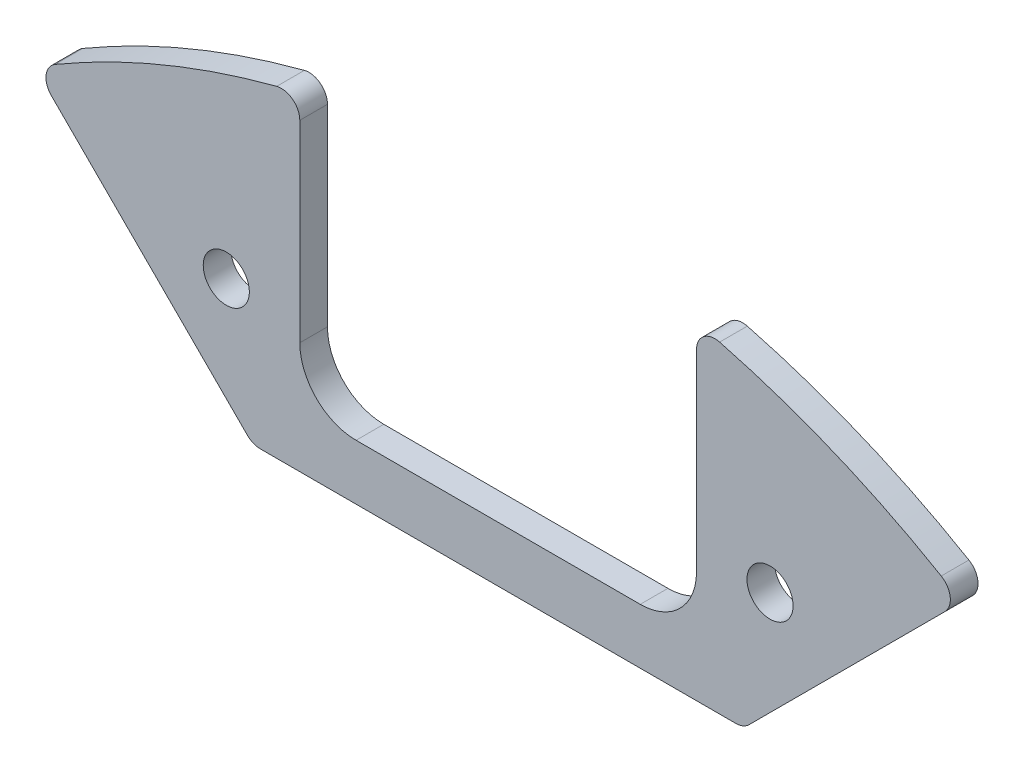
from build123d import *

# Parameters (mm, degrees)
SKETCH_1_R                       = 47.5
EXTRUDE_1_DEPTH                  = 1.5
CUT_EXTRUDE_1_DEPTH              = 68.191889392
CUT_EXTRUDE_2_DEPTH              = 68.191889392
CUT_EXTRUDE_2_DEPTH_BACK         = 68.191889392
SKETCH_3_R                       = 3.1
SKETCH_3_R_2                     = 1.6
SKETCH_4_R                       = 1.25
CUT_EXTRUDE_3_DEPTH              = 68.191889392
CUT_EXTRUDE_4_DEPTH              = 68.191889392
FILLET_1_R                       = 1
FILLET_2_R                       = 0.2
FILLET_3_R                       = 3.05
PATTERN_CIRCULAR_1_COUNT         = 8
FILLET_1_OF_PATTERN_CIRCULAR_1_R = 1
FILLET_2_OF_PATTERN_CIRCULAR_1_R = 0.2
FILLET_3_OF_PATTERN_CIRCULAR_1_R = 3.05
CUT_EXTRUDE_5_DEPTH              = 66.05834985
EXTRUDE_START                    = -1.5
EXTRUDE_2_DEPTH                  = 1.5
FILLET_4_R                       = 1


with BuildPart() as part:
    # ｽｹｯﾁ1 → ﾎﾞｽ - 押し出し1 (new body)
    with BuildSketch(Plane.XY):
        Circle(SKETCH_1_R)
    extrude(amount=EXTRUDE_1_DEPTH)

    # ｽｹｯﾁ2 → ｶｯﾄ - 押し出し1 (cut, through all)
    with BuildSketch(Plane.XY.offset(1.5)):
        Polygon((-10.75, 43.525), (-10.75, 52.5), (10.75, 52.5), (10.75, 43.525), (13, 43.525), (13, 40.475), (10.75, 40.475), (10.75, 31.5), (-10.75, 31.5), (-10.75, 40.475), (-13, 40.475), (-13, 43.525), align=None)
    cut_extrude_1 = extrude(amount=-CUT_EXTRUDE_1_DEPTH, mode=Mode.SUBTRACT)

    # ｽｹｯﾁ3 → ｶｯﾄ - 押し出し2 (cut, two sides: drawn at the far end of the back side and taken through both)
    with BuildSketch(Plane.XY.offset(1.5).offset(-CUT_EXTRUDE_2_DEPTH_BACK)):
        Circle(SKETCH_3_R)
        with Locations((0, 6.5)):
            Circle(SKETCH_3_R_2)
        with Locations((6.5, 0)):
            Circle(SKETCH_3_R_2)
        with Locations((0, -6.5)):
            Circle(SKETCH_3_R_2)
        with Locations((-6.5, 0)):
            Circle(SKETCH_3_R_2)
        with Locations((8.838834765, 8.838834765)):
            Circle(SKETCH_3_R_2)
        with Locations((8.838834765, -8.838834765)):
            Circle(SKETCH_3_R_2)
        with Locations((-8.838834765, -8.838834765)):
            Circle(SKETCH_3_R_2)
        with Locations((-8.838834765, 8.838834765)):
            Circle(SKETCH_3_R_2)
    extrude(amount=CUT_EXTRUDE_2_DEPTH + CUT_EXTRUDE_2_DEPTH_BACK, mode=Mode.SUBTRACT)

    # ｽｹｯﾁ4 → ｶｯﾄ - 押し出し3 (cut, through all)
    with BuildSketch(Plane.XY.offset(1.5)):
        with Locations((14.733312146, 35.569362002)):
            Circle(SKETCH_4_R)
        with Locations((8.610377228, 20.787289482)):
            Circle(SKETCH_4_R)
    cut_extrude_3 = extrude(amount=-CUT_EXTRUDE_3_DEPTH, mode=Mode.SUBTRACT)

    # ｽｹｯﾁ5 → ｶｯﾄ - 押し出し4 (cut, symmetric)
    with BuildSketch(Plane.XY.offset(1.5)):
        Polygon((-7.188286702, 26.5), (7.188286702, 26.5), (3.328075632, 17.180626082), (-3.328075632, 17.180626082), align=None)
    cut_extrude_4 = extrude(amount=CUT_EXTRUDE_4_DEPTH, both=True, mode=Mode.SUBTRACT)

    # ﾌｨﾚｯﾄ1
    fillet_1_edges = [part.edges().sort_by_distance(p)[0] for p in [
        (-3.328075632, 17.180626082, 0.75),
        (3.328075632, 17.180626082, 0.75),
        (7.188286702, 26.5, 0.75),
        (-7.188286702, 26.5, 0.75),
        (10.75, 46.267564232, 0.75),
        (-10.75, 46.267564232, 0.75),
    ]]
    fillet(fillet_1_edges, radius=FILLET_1_R)

    # ﾌｨﾚｯﾄ2
    fillet_2_edges = [part.edges().sort_by_distance(p)[0] for p in [
        (13, 43.525, 0.75),
        (13, 40.475, 0.75),
        (-13, 43.525, 0.75),
        (-13, 40.475, 0.75),
    ]]
    fillet(fillet_2_edges, radius=FILLET_2_R)

    # ﾌｨﾚｯﾄ3
    fillet_3_edges = [part.edges().sort_by_distance(p)[0] for p in [
        (10.75, 31.5, 0.75),
        (-10.75, 31.5, 0.75),
    ]]
    fillet(fillet_3_edges, radius=FILLET_3_R)

    # 円形ﾊﾟﾀｰﾝ1: ｶｯﾄ - 押し出し1, ｶｯﾄ - 押し出し3, ｶｯﾄ - 押し出し4 ×8 about axis
    pattern_circular_1_axis = Axis((0, 0, 0), (0, 0, 1))
    add([cut_extrude_1.rotate(pattern_circular_1_axis, i * 360 / PATTERN_CIRCULAR_1_COUNT) for i in range(1, PATTERN_CIRCULAR_1_COUNT)], mode=Mode.SUBTRACT)
    add([cut_extrude_3.rotate(pattern_circular_1_axis, i * 360 / PATTERN_CIRCULAR_1_COUNT) for i in range(1, PATTERN_CIRCULAR_1_COUNT)], mode=Mode.SUBTRACT)
    add([cut_extrude_4.rotate(pattern_circular_1_axis, i * 360 / PATTERN_CIRCULAR_1_COUNT) for i in range(1, PATTERN_CIRCULAR_1_COUNT)], mode=Mode.SUBTRACT)

    # ﾌｨﾚｯﾄ1 of 円形ﾊﾟﾀｰﾝ1
    fillet_1_of_pattern_circular_1_edges = [part.edges().sort_by_distance(p)[0] for p in [
        (-14.501842056, 9.79523236, 0.75),
        (-9.79523236, 14.501842056, 0.75),
        (-13.655443429, 23.821215973, 0.75),
        (-23.821215973, 13.655443429, 0.75),
        (-25.11471052, 40.317506315, 0.75),
        (-40.317506315, 25.11471052, 0.75),
        (-17.180626082, -3.328075632, 0.75),
        (-17.180626082, 3.328075632, 0.75),
        (-26.5, 7.188286702, 0.75),
        (-26.5, -7.188286702, 0.75),
        (-46.267564232, 10.75, 0.75),
        (-46.267564232, -10.75, 0.75),
        (-9.79523236, -14.501842056, 0.75),
        (-14.501842056, -9.79523236, 0.75),
        (-23.821215973, -13.655443429, 0.75),
        (-13.655443429, -23.821215973, 0.75),
        (-40.317506315, -25.11471052, 0.75),
        (-25.11471052, -40.317506315, 0.75),
        (3.328075632, -17.180626082, 0.75),
        (-3.328075632, -17.180626082, 0.75),
        (-7.188286702, -26.5, 0.75),
        (7.188286702, -26.5, 0.75),
        (-10.75, -46.267564232, 0.75),
        (10.75, -46.267564232, 0.75),
        (14.501842056, -9.79523236, 0.75),
        (9.79523236, -14.501842056, 0.75),
        (13.655443429, -23.821215973, 0.75),
        (23.821215973, -13.655443429, 0.75),
        (25.11471052, -40.317506315, 0.75),
        (40.317506315, -25.11471052, 0.75),
        (17.180626082, 3.328075632, 0.75),
        (17.180626082, -3.328075632, 0.75),
        (26.5, -7.188286702, 0.75),
        (26.5, 7.188286702, 0.75),
        (46.267564232, -10.75, 0.75),
        (46.267564232, 10.75, 0.75),
        (9.79523236, 14.501842056, 0.75),
        (14.501842056, 9.79523236, 0.75),
        (23.821215973, 13.655443429, 0.75),
        (13.655443429, 23.821215973, 0.75),
        (40.317506315, 25.11471052, 0.75),
        (25.11471052, 40.317506315, 0.75),
    ]]
    fillet(fillet_1_of_pattern_circular_1_edges, radius=FILLET_1_OF_PATTERN_CIRCULAR_1_R)

    # ﾌｨﾚｯﾄ2 of 円形ﾊﾟﾀｰﾝ1
    fillet_2_of_pattern_circular_1_edges = [part.edges().sort_by_distance(p)[0] for p in [
        (-21.584434496, 39.969210807, 0.75),
        (-19.427758813, 37.812535124, 0.75),
        (-39.969210807, 21.584434496, 0.75),
        (-37.812535124, 19.427758813, 0.75),
        (-43.525, 13, 0.75),
        (-40.475, 13, 0.75),
        (-43.525, -13, 0.75),
        (-40.475, -13, 0.75),
        (-39.969210807, -21.584434496, 0.75),
        (-37.812535124, -19.427758813, 0.75),
        (-21.584434496, -39.969210807, 0.75),
        (-19.427758813, -37.812535124, 0.75),
        (-13, -43.525, 0.75),
        (-13, -40.475, 0.75),
        (13, -43.525, 0.75),
        (13, -40.475, 0.75),
        (21.584434496, -39.969210807, 0.75),
        (19.427758813, -37.812535124, 0.75),
        (39.969210807, -21.584434496, 0.75),
        (37.812535124, -19.427758813, 0.75),
        (43.525, -13, 0.75),
        (40.475, -13, 0.75),
        (43.525, 13, 0.75),
        (40.475, 13, 0.75),
        (39.969210807, 21.584434496, 0.75),
        (37.812535124, 19.427758813, 0.75),
        (21.584434496, 39.969210807, 0.75),
        (19.427758813, 37.812535124, 0.75),
    ]]
    fillet(fillet_2_of_pattern_circular_1_edges, radius=FILLET_2_OF_PATTERN_CIRCULAR_1_R)

    # ﾌｨﾚｯﾄ3 of 円形ﾊﾟﾀｰﾝ1
    fillet_3_of_pattern_circular_1_edges = [part.edges().sort_by_distance(p)[0] for p in [
        (-14.67246571, 29.875261505, 0.75),
        (-29.875261505, 14.67246571, 0.75),
        (-31.5, 10.75, 0.75),
        (-31.5, -10.75, 0.75),
        (-29.875261505, -14.67246571, 0.75),
        (-14.67246571, -29.875261505, 0.75),
        (-10.75, -31.5, 0.75),
        (10.75, -31.5, 0.75),
        (14.67246571, -29.875261505, 0.75),
        (29.875261505, -14.67246571, 0.75),
        (31.5, -10.75, 0.75),
        (31.5, 10.75, 0.75),
        (29.875261505, 14.67246571, 0.75),
        (14.67246571, 29.875261505, 0.75),
    ]]
    fillet(fillet_3_of_pattern_circular_1_edges, radius=FILLET_3_OF_PATTERN_CIRCULAR_1_R)

    # ｽｹｯﾁ6 → ｶｯﾄ - 押し出し5 (cut, through all)
    with BuildSketch(Plane.XY.offset(1.5)):
        with BuildLine():
            Line((13.297204204, 28.5), (7.7, 28.5))
            Line((7.7, 28.5), (-7.7, 28.5))
            Line((-7.7, 28.5), (-13.297204204, 28.5))
            Line((-13.297204204, 28.5), (-16.829141392, 32.031937188))
            ThreePointArc((-16.829141392, 32.031937188), (-15.935817075, 29.875261505), (-16.829141392, 27.718585823))
            Line((-16.829141392, 27.718585823), (-27.718585823, 16.829141392))
            ThreePointArc((-27.718585823, 16.829141392), (-29.875261505, 15.935817075), (-32.031937188, 16.829141392))
            Line((-32.031937188, 16.829141392), (-36.221544866, 21.018749071))
            Line((-36.221544866, 21.018749071), (-37.671113768, 19.569180169))
            ThreePointArc((-37.671113768, 19.569180169), (-37.812535124, 19.510601526), (-37.95395648, 19.569180169))
            Line((-37.95395648, 19.569180169), (-39.82778945, 21.443013139))
            ThreePointArc((-39.82778945, 21.443013139), (-39.886368094, 21.584434496), (-39.82778945, 21.725855852))
            Line((-39.82778945, 21.725855852), (-38.378220549, 23.175424753))
            Line((-38.378220549, 23.175424753), (-39.414818808, 24.212023012))
            ThreePointArc((-39.414818808, 24.212023012), (-40.249307357, 24.496769993), (-40.984762698, 24.010398301))
            ThreePointArc((-40.984762698, 24.010398301), (-43.884277794, 18.177463037), (-45.958519087, 12.002688172))
            ThreePointArc((-45.958519087, 12.002688172), (-45.78239035, 11.138725991), (-44.990971316, 10.75))
            Line((-44.990971316, 10.75), (-43.525, 10.75))
            Line((-43.525, 10.75), (-43.525, 12.8))
            ThreePointArc((-43.525, 12.8), (-43.466421356, 12.941421356), (-43.325, 13))
            Line((-43.325, 13), (-40.675, 13))
            ThreePointArc((-40.675, 13), (-40.533578644, 12.941421356), (-40.475, 12.8))
            Line((-40.475, 12.8), (-40.475, 10.75))
            Line((-40.475, 10.75), (-34.55, 10.75))
            ThreePointArc((-34.55, 10.75), (-32.393324317, 9.856675683), (-31.5, 7.7))
            Line((-31.5, 7.7), (-31.5, -7.7))
            ThreePointArc((-31.5, -7.7), (-32.393324317, -9.856675683), (-34.55, -10.75))
            Line((-34.55, -10.75), (-40.475, -10.75))
            Line((-40.475, -10.75), (-40.475, -12.8))
            ThreePointArc((-40.475, -12.8), (-40.533578644, -12.941421356), (-40.675, -13))
            Line((-40.675, -13), (-43.325, -13))
            ThreePointArc((-43.325, -13), (-43.466421356, -12.941421356), (-43.525, -12.8))
            Line((-43.525, -12.8), (-43.525, -10.75))
            Line((-43.525, -10.75), (-44.990971316, -10.75))
            ThreePointArc((-44.990971316, -10.75), (-45.78239035, -11.138725991), (-45.958519087, -12.002688172))
            ThreePointArc((-45.958519087, -12.002688172), (-43.884277794, -18.177463037), (-40.984762698, -24.010398301))
            ThreePointArc((-40.984762698, -24.010398301), (-40.249307357, -24.496769993), (-39.414818808, -24.212023012))
            Line((-39.414818808, -24.212023012), (-38.378220549, -23.175424753))
            Line((-38.378220549, -23.175424753), (-39.82778945, -21.725855852))
            ThreePointArc((-39.82778945, -21.725855852), (-39.886368094, -21.584434496), (-39.82778945, -21.443013139))
            Line((-39.82778945, -21.443013139), (-37.95395648, -19.569180169))
            ThreePointArc((-37.95395648, -19.569180169), (-37.812535124, -19.510601526), (-37.671113768, -19.569180169))
            Line((-37.671113768, -19.569180169), (-36.221544866, -21.018749071))
            Line((-36.221544866, -21.018749071), (-32.031937188, -16.829141392))
            ThreePointArc((-32.031937188, -16.829141392), (-29.875261505, -15.935817075), (-27.718585823, -16.829141392))
            Line((-27.718585823, -16.829141392), (-16.829141392, -27.718585823))
            ThreePointArc((-16.829141392, -27.718585823), (-15.935817075, -29.875261505), (-16.829141392, -32.031937188))
            Line((-16.829141392, -32.031937188), (-21.018749071, -36.221544866))
            Line((-21.018749071, -36.221544866), (-19.569180169, -37.671113768))
            ThreePointArc((-19.569180169, -37.671113768), (-19.510601526, -37.812535124), (-19.569180169, -37.95395648))
            Line((-19.569180169, -37.95395648), (-21.443013139, -39.82778945))
            ThreePointArc((-21.443013139, -39.82778945), (-21.584434496, -39.886368094), (-21.725855852, -39.82778945))
            Line((-21.725855852, -39.82778945), (-23.175424753, -38.378220549))
            Line((-23.175424753, -38.378220549), (-24.212023012, -39.414818808))
            ThreePointArc((-24.212023012, -39.414818808), (-24.496769993, -40.249307357), (-24.010398301, -40.984762698))
            ThreePointArc((-24.010398301, -40.984762698), (-18.177463037, -43.884277794), (-12.002688172, -45.958519087))
            ThreePointArc((-12.002688172, -45.958519087), (-11.138725991, -45.78239035), (-10.75, -44.990971316))
            Line((-10.75, -44.990971316), (-10.75, -43.525))
            Line((-10.75, -43.525), (-12.8, -43.525))
            ThreePointArc((-12.8, -43.525), (-12.941421356, -43.466421356), (-13, -43.325))
            Line((-13, -43.325), (-13, -40.675))
            ThreePointArc((-13, -40.675), (-12.941421356, -40.533578644), (-12.8, -40.475))
            Line((-12.8, -40.475), (-10.75, -40.475))
            Line((-10.75, -40.475), (-10.75, -34.55))
            ThreePointArc((-10.75, -34.55), (-9.856675683, -32.393324317), (-7.7, -31.5))
            Line((-7.7, -31.5), (7.7, -31.5))
            ThreePointArc((7.7, -31.5), (9.856675683, -32.393324317), (10.75, -34.55))
            Line((10.75, -34.55), (10.75, -40.475))
            Line((10.75, -40.475), (12.8, -40.475))
            ThreePointArc((12.8, -40.475), (12.941421356, -40.533578644), (13, -40.675))
            Line((13, -40.675), (13, -43.325))
            ThreePointArc((13, -43.325), (12.941421356, -43.466421356), (12.8, -43.525))
            Line((12.8, -43.525), (10.75, -43.525))
            Line((10.75, -43.525), (10.75, -44.990971316))
            ThreePointArc((10.75, -44.990971316), (11.138725991, -45.78239035), (12.002688172, -45.958519087))
            ThreePointArc((12.002688172, -45.958519087), (18.177463037, -43.884277794), (24.010398301, -40.984762698))
            ThreePointArc((24.010398301, -40.984762698), (24.496769993, -40.249307357), (24.212023012, -39.414818808))
            Line((24.212023012, -39.414818808), (23.175424753, -38.378220549))
            Line((23.175424753, -38.378220549), (21.725855852, -39.82778945))
            ThreePointArc((21.725855852, -39.82778945), (21.584434496, -39.886368094), (21.443013139, -39.82778945))
            Line((21.443013139, -39.82778945), (19.569180169, -37.95395648))
            ThreePointArc((19.569180169, -37.95395648), (19.510601526, -37.812535124), (19.569180169, -37.671113768))
            Line((19.569180169, -37.671113768), (21.018749071, -36.221544866))
            Line((21.018749071, -36.221544866), (16.829141392, -32.031937188))
            ThreePointArc((16.829141392, -32.031937188), (15.935817075, -29.875261505), (16.829141392, -27.718585823))
            Line((16.829141392, -27.718585823), (27.718585823, -16.829141392))
            ThreePointArc((27.718585823, -16.829141392), (29.875261505, -15.935817075), (32.031937188, -16.829141392))
            Line((32.031937188, -16.829141392), (36.221544866, -21.018749071))
            Line((36.221544866, -21.018749071), (37.671113768, -19.569180169))
            ThreePointArc((37.671113768, -19.569180169), (37.812535124, -19.510601526), (37.95395648, -19.569180169))
            Line((37.95395648, -19.569180169), (39.82778945, -21.443013139))
            ThreePointArc((39.82778945, -21.443013139), (39.886368094, -21.584434496), (39.82778945, -21.725855852))
            Line((39.82778945, -21.725855852), (38.378220549, -23.175424753))
            Line((38.378220549, -23.175424753), (39.414818808, -24.212023012))
            ThreePointArc((39.414818808, -24.212023012), (40.249307357, -24.496769993), (40.984762698, -24.010398301))
            ThreePointArc((40.984762698, -24.010398301), (43.884277794, -18.177463037), (45.958519087, -12.002688172))
            ThreePointArc((45.958519087, -12.002688172), (45.78239035, -11.138725991), (44.990971316, -10.75))
            Line((44.990971316, -10.75), (43.525, -10.75))
            Line((43.525, -10.75), (43.525, -12.8))
            ThreePointArc((43.525, -12.8), (43.466421356, -12.941421356), (43.325, -13))
            Line((43.325, -13), (40.675, -13))
            ThreePointArc((40.675, -13), (40.533578644, -12.941421356), (40.475, -12.8))
            Line((40.475, -12.8), (40.475, -10.75))
            Line((40.475, -10.75), (34.55, -10.75))
            ThreePointArc((34.55, -10.75), (32.393324317, -9.856675683), (31.5, -7.7))
            Line((31.5, -7.7), (31.5, 7.7))
            ThreePointArc((31.5, 7.7), (32.393324317, 9.856675683), (34.55, 10.75))
            Line((34.55, 10.75), (40.475, 10.75))
            Line((40.475, 10.75), (40.475, 12.8))
            ThreePointArc((40.475, 12.8), (40.533578644, 12.941421356), (40.675, 13))
            Line((40.675, 13), (43.325, 13))
            ThreePointArc((43.325, 13), (43.466421356, 12.941421356), (43.525, 12.8))
            Line((43.525, 12.8), (43.525, 10.75))
            Line((43.525, 10.75), (44.990971316, 10.75))
            ThreePointArc((44.990971316, 10.75), (45.78239035, 11.138725991), (45.958519087, 12.002688172))
            ThreePointArc((45.958519087, 12.002688172), (43.884277794, 18.177463037), (40.984762698, 24.010398301))
            ThreePointArc((40.984762698, 24.010398301), (40.249307357, 24.496769993), (39.414818808, 24.212023012))
            Line((39.414818808, 24.212023012), (38.378220549, 23.175424753))
            Line((38.378220549, 23.175424753), (39.82778945, 21.725855852))
            ThreePointArc((39.82778945, 21.725855852), (39.886368094, 21.584434496), (39.82778945, 21.443013139))
            Line((39.82778945, 21.443013139), (37.95395648, 19.569180169))
            ThreePointArc((37.95395648, 19.569180169), (37.812535124, 19.510601526), (37.671113768, 19.569180169))
            Line((37.671113768, 19.569180169), (36.221544866, 21.018749071))
            Line((36.221544866, 21.018749071), (32.031937188, 16.829141392))
            ThreePointArc((32.031937188, 16.829141392), (29.875261505, 15.935817075), (27.718585823, 16.829141392))
            Line((27.718585823, 16.829141392), (16.829141392, 27.718585823))
            ThreePointArc((16.829141392, 27.718585823), (15.935817075, 29.875261505), (16.829141392, 32.031937188))
            Line((16.829141392, 32.031937188), (13.297204204, 28.5))
        make_face()
    extrude(amount=-CUT_EXTRUDE_5_DEPTH, mode=Mode.SUBTRACT)

    # ｽｹｯﾁ7 → ﾎﾞｽ - 押し出し2 (add)
    with BuildSketch(Plane.XY.offset(1.5).offset(EXTRUDE_START)):
        with BuildLine():
            Line((-10.75, 40.475), (-10.75, 43.525))
            Line((-10.75, 43.525), (-12.8, 43.525))
            ThreePointArc((-12.8, 43.525), (-12.941421356, 43.466421356), (-13, 43.325))
            Line((-13, 43.325), (-13, 40.675))
            ThreePointArc((-13, 40.675), (-12.941421356, 40.533578644), (-12.8, 40.475))
            Line((-12.8, 40.475), (-10.75, 40.475))
        make_face()
        with BuildLine():
            Line((-21.725855852, 39.82778945), (-23.175424753, 38.378220549))
            Line((-23.175424753, 38.378220549), (-21.018749071, 36.221544866))
            Line((-21.018749071, 36.221544866), (-19.569180169, 37.671113768))
            ThreePointArc((-19.569180169, 37.671113768), (-19.510601526, 37.812535124), (-19.569180169, 37.95395648))
            Line((-19.569180169, 37.95395648), (-21.443013139, 39.82778945))
            ThreePointArc((-21.443013139, 39.82778945), (-21.584434496, 39.886368094), (-21.725855852, 39.82778945))
        make_face()
        with BuildLine():
            Line((10.75, 43.525), (10.75, 40.475))
            Line((10.75, 40.475), (12.8, 40.475))
            ThreePointArc((12.8, 40.475), (12.941421356, 40.533578644), (13, 40.675))
            Line((13, 40.675), (13, 43.325))
            ThreePointArc((13, 43.325), (12.941421356, 43.466421356), (12.8, 43.525))
            Line((12.8, 43.525), (10.75, 43.525))
        make_face()
        with BuildLine():
            Line((19.569180169, 37.671113768), (21.018749071, 36.221544866))
            Line((21.018749071, 36.221544866), (23.175424753, 38.378220549))
            Line((23.175424753, 38.378220549), (21.725855852, 39.82778945))
            ThreePointArc((21.725855852, 39.82778945), (21.584434496, 39.886368094), (21.443013139, 39.82778945))
            Line((21.443013139, 39.82778945), (19.569180169, 37.95395648))
            ThreePointArc((19.569180169, 37.95395648), (19.510601526, 37.812535124), (19.569180169, 37.671113768))
        make_face()
    extrude(amount=EXTRUDE_2_DEPTH)

    # ﾌｨﾚｯﾄ4
    fillet_4_edges = [part.edges().sort_by_distance(p)[0] for p in [
        (13.297204204, 28.5, 0.75),
        (-13.297204204, 28.5, 0.75),
    ]]
    fillet(fillet_4_edges, radius=FILLET_4_R)


solid = part.part
